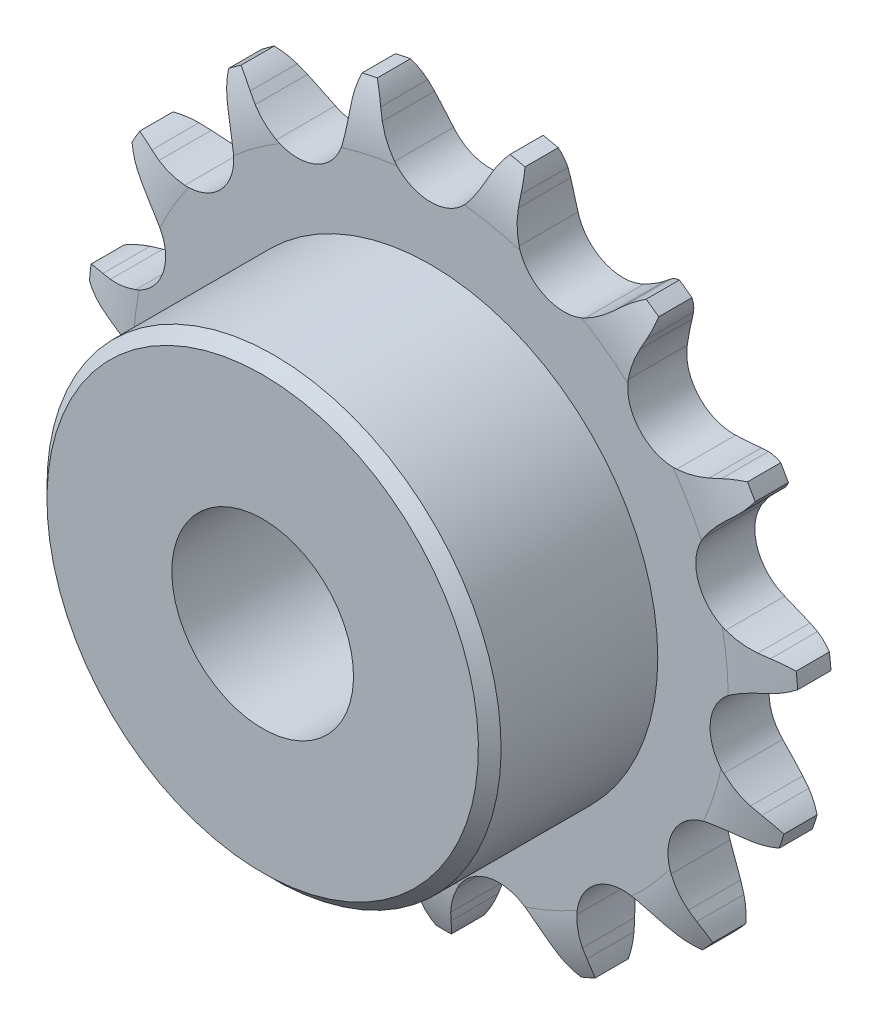
from build123d import *

# Parameters (mm, degrees)
CUT_EXTRUDE1_DEPTH      = 23.54315441
CIRPATTERN1_COUNT       = 15
BOSS_EXTRUDE1_START     = 1.3
SKETCH2_R               = 10
BOSS_EXTRUDE1_DEPTH     = 7.4
CUT_EXTRUDE2_DEPTH      = 25.083300715
CUT_EXTRUDE2_DEPTH_BACK = 25.083300715
SKETCH3_R               = 3
SKETCH4_W               = 1.95
SKETCH4_H               = 5.584687294
CUT_EXTRUDE3_DEPTH      = 25.083300715
CUT_EXTRUDE3_DEPTH_BACK = 25.083300715
SKETCH5_OUTSIDE_W       = 42.85
SKETCH5_OUTSIDE_H       = 42.678
SKETCH5_OUTSIDE_R       = 15.65
SKETCH6_R               = 4
CUT_EXTRUDE4_DEPTH      = 25.25205437


with BuildPart() as part:
    # Sketch1 → Revolve1 (revolve)
    with BuildSketch(Plane(origin=(0, 0, 0), x_dir=(0, 0, -1), z_dir=(1, 0, 0))):
        with BuildLine():
            Line((1.3, 0), (-1.3, 0))
            Line((-1.3, 0), (-1.3, 13.101418106))
            ThreePointArc((-1.3, 13.101418106), (-1.122370651, 14.550555781), (-0.6, 15.913890328))
            Line((-0.6, 15.913890328), (0.6, 15.913890328))
            ThreePointArc((0.6, 15.913890328), (1.122370651, 14.550555781), (1.3, 13.101418106))
            Line((1.3, 13.101418106), (1.3, 0))
        make_face()
    revolve(axis=Axis((0, 0, -1.3), (0, 0, 1)))

    # Sketch0 → Cut-Extrude1 (cut, symmetric)
    with BuildSketch(Plane.XY):
        with BuildLine():
            Line((5.458731892, -13.819129077), (5.192148114, -13.461913404))
            ThreePointArc((5.192148114, -13.461913404), (4.769815507, -12.963915887), (4.288911093, -12.522217685))
            ThreePointArc((4.288911093, -12.522217685), (2.574176066, -12.110546227), (1.175129538, -13.184072386))
            ThreePointArc((1.175129538, -13.184072386), (0.915456339, -13.78318522), (0.732190143, -14.409906736))
            Line((0.732190143, -14.409906736), (0.633946447, -14.844668882))
            ThreePointArc((0.633946447, -14.844668882), (-0.774190712, -16.881356201), (-3.200657759, -17.374512534))
            ThreePointArc((-3.200657759, -17.374512534), (3.673146461, -17.280795438), (9.99079726, -14.570582212))
            ThreePointArc((9.99079726, -14.570582212), (7.573524561, -15.106994545), (5.458731892, -13.819129077))
        make_face()
    cut_extrude1 = extrude(amount=CUT_EXTRUDE1_DEPTH, both=True, mode=Mode.SUBTRACT)

    # CirPattern1: Cut-Extrude1 ×15 about axis
    cirpattern1_axis = Axis((0, 0, 0), (0, 0, 1))
    for i in range(1, CIRPATTERN1_COUNT):
        add(cut_extrude1.rotate(cirpattern1_axis, i * 360 / CIRPATTERN1_COUNT), mode=Mode.SUBTRACT)

    # Sketch2 → Boss-Extrude1 (add)
    with BuildSketch(Plane.XY.offset(BOSS_EXTRUDE1_START)):
        with Locations(Location((0, 0, 0), (0, 0, 270))):
            Circle(SKETCH2_R)
    extrude(amount=BOSS_EXTRUDE1_DEPTH)

    # Sketch3 → Cut-Extrude2 (cut, two sides: drawn at the far end of the back side and taken through both)
    with BuildSketch(Plane.XY.offset(-CUT_EXTRUDE2_DEPTH_BACK)):
        Circle(SKETCH3_R)
    extrude(amount=CUT_EXTRUDE2_DEPTH + CUT_EXTRUDE2_DEPTH_BACK, mode=Mode.SUBTRACT)

    # Sketch4 → Cut-Revolve1 (revolve, cut)
    with BuildSketch(Plane(origin=(0, 0, 0), x_dir=(0, 0, -1), z_dir=(1, 0, 0))):
        Polygon((-8.7, 10), (-8.7, 9.5), (-8.2, 10), align=None)
        with Locations((-2.275, 13.121546681)):
            Rectangle(SKETCH4_W, SKETCH4_H)
    revolve(axis=Axis((0, 0, -1.3), (0, 0, 1)), mode=Mode.SUBTRACT)

    # Sketch5 outside → Cut-Extrude3 (cut, two sides: drawn at the far end of the back side and taken through both)
    with BuildSketch(Plane.XY.offset(-CUT_EXTRUDE3_DEPTH_BACK)):
        with Locations((0, -0.155)):
            Rectangle(SKETCH5_OUTSIDE_W, SKETCH5_OUTSIDE_H)
        Circle(SKETCH5_OUTSIDE_R, mode=Mode.SUBTRACT)
    extrude(amount=CUT_EXTRUDE3_DEPTH + CUT_EXTRUDE3_DEPTH_BACK, mode=Mode.SUBTRACT)

    # Sketch6 → Cut-Extrude4 (cut, through all)
    with BuildSketch(Plane(origin=(0, 0, -1.3), x_dir=(-1, 0, 0), z_dir=(0, 0, -1))):
        with Locations(Location((0, 0, 0), (0, 0, 90))):
            Circle(SKETCH6_R)
    extrude(amount=-CUT_EXTRUDE4_DEPTH, mode=Mode.SUBTRACT)


solid = part.part
